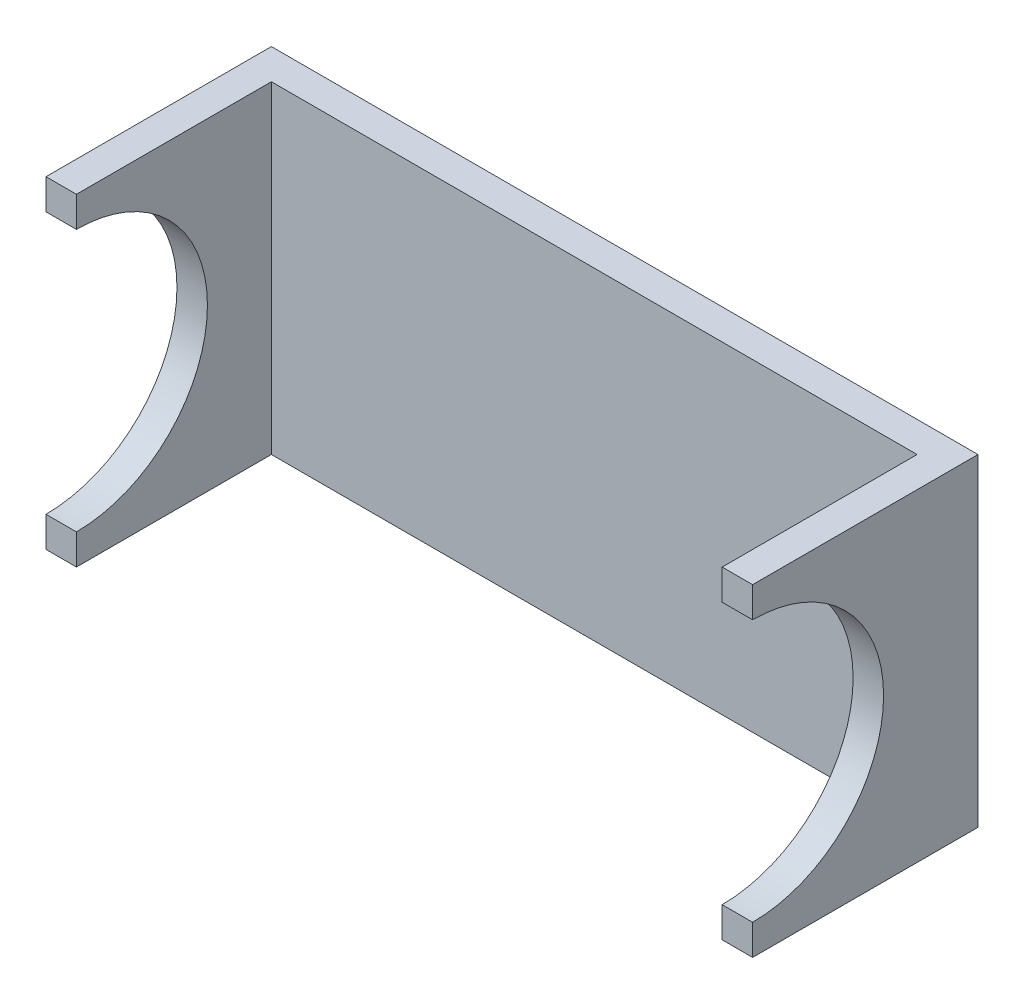
from build123d import *

# Parameters (mm, degrees)
SKETCH_1_W          = 116
SKETCH_1_H          = 53
EXTRUDE_1_DEPTH     = 5
SKETCH_2_W          = 5
SKETCH_2_H          = 53
EXTRUDE_2_DEPTH     = 32
SKETCH_3_R          = 21.5
CUT_EXTRUDE_1_DEPTH = 125.608386556
SKETCH_4_R          = 5
EXTRUDE_3_DEPTH     = 12


with BuildPart() as part:
    # 草图1 → 凸台-拉伸1 (new body)
    with BuildSketch(Plane.XY):
        Rectangle(SKETCH_1_W, SKETCH_1_H)
    extrude(amount=EXTRUDE_1_DEPTH)

    # 草图2 → 凸台-拉伸2 (add)
    with BuildSketch(Plane.XY.offset(5)):
        with Locations((-55.5, 0)):
            Rectangle(SKETCH_2_W, SKETCH_2_H)
    extrude_2 = extrude(amount=EXTRUDE_2_DEPTH)

    # 镜向1: 凸台-拉伸2 across plane
    add(extrude_2.mirror(Plane(origin=(0, 0, 0), x_dir=(0, 0, 1), z_dir=(1, 0, 0))))

    # 草图3 → 切除-拉伸1 (cut, through all)
    with BuildSketch(Plane.ZY.offset(58)):
        with Locations((37, 0)):
            Circle(SKETCH_3_R)
    extrude(amount=-CUT_EXTRUDE_1_DEPTH, mode=Mode.SUBTRACT)

    # 草图4 → 凸台-拉伸3 (add)
    with BuildSketch(Plane(origin=(0, 0, 0), x_dir=(-1, 0, 0), z_dir=(0, 0, -1))):
        with Locations(Location((0, 0, 0), (0, 0, 180))):
            Circle(SKETCH_4_R)
    extrude(amount=EXTRUDE_3_DEPTH)


solid = part.part
